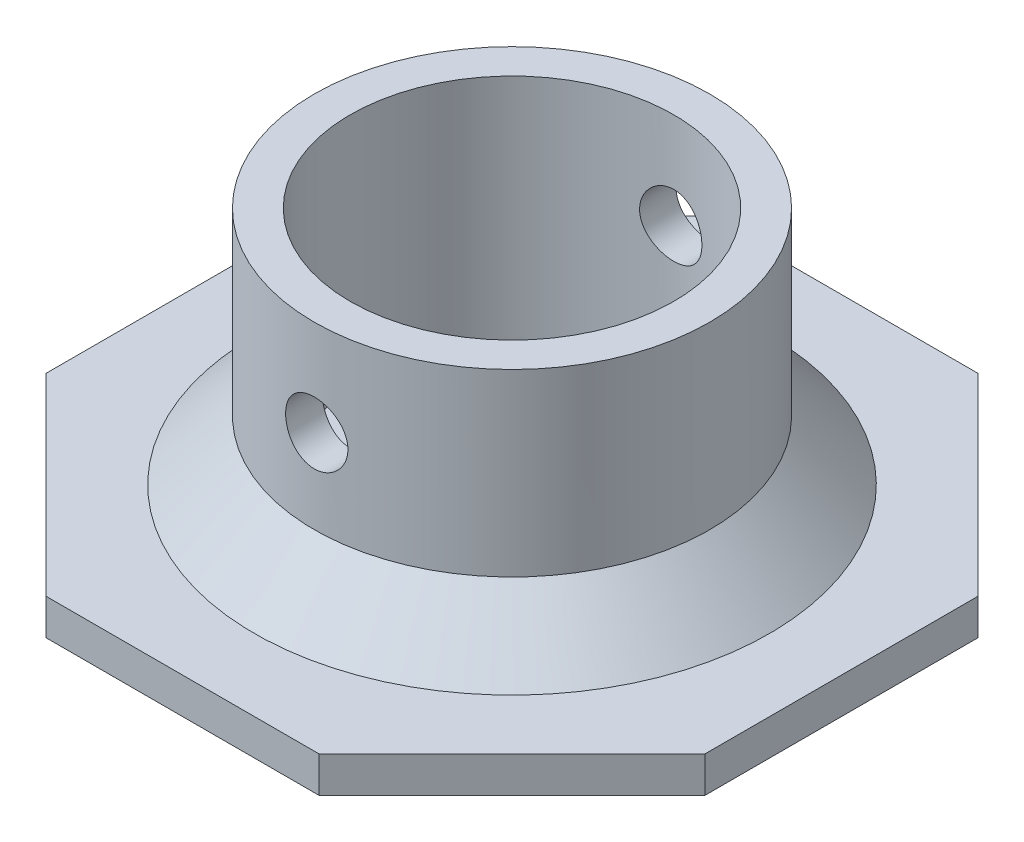
from build123d import *

# Parameters (mm, degrees)
BOSS_EXTRUDE1_DEPTH     = 3
SKETCH4_R               = 16.5
SKETCH4_R_2             = 13.5
BOSS_EXTRUDE2_DEPTH     = 20
CUT_EXTRUDE1_DEPTH      = 46.18296139
CUT_EXTRUDE1_DEPTH_BACK = 46.18296139
SKETCH5_R               = 2.6
CHAMFER1_SIZE           = 5


with BuildPart() as part:
    # Sketch2 → Boss-Extrude1 (new body)
    with BuildSketch(Plane(origin=(0, 0, 0), x_dir=(1, 0, 0), z_dir=(0, 1, 0))):
        Polygon((-11.390872965, 27.5), (-27.5, 11.390872965), (-27.5, -11.390872965), (-11.390872965, -27.5), (11.390872965, -27.5), (27.5, -11.390872965), (27.5, 11.390872965), (11.390872965, 27.5), align=None)
    extrude(amount=BOSS_EXTRUDE1_DEPTH)

    # Sketch4 → Boss-Extrude2 (add)
    with BuildSketch(Plane(origin=(0, 3, 0), x_dir=(1, 0, 0), z_dir=(0, 1, 0))):
        with Locations(Location((0, 0, 0), (0, 0, 270))):
            Circle(SKETCH4_R)
        with Locations(Location((0, 0, 0), (0, 0, 270))):
            Circle(SKETCH4_R_2, mode=Mode.SUBTRACT)
    extrude(amount=BOSS_EXTRUDE2_DEPTH)

    # Sketch5 → Cut-Extrude1 (cut, two sides: drawn at the far end of the back side and taken through both)
    with BuildSketch(Plane.XY.offset(-CUT_EXTRUDE1_DEPTH_BACK)):
        with Locations((0, 15)):
            Circle(SKETCH5_R)
    extrude(amount=CUT_EXTRUDE1_DEPTH + CUT_EXTRUDE1_DEPTH_BACK, mode=Mode.SUBTRACT)

    # Chamfer1
    chamfer1_edges = [part.edges().sort_by_distance(p)[0] for p in [
        (0, 3, -16.5),
    ]]
    chamfer(chamfer1_edges, length=CHAMFER1_SIZE)


solid = part.part
